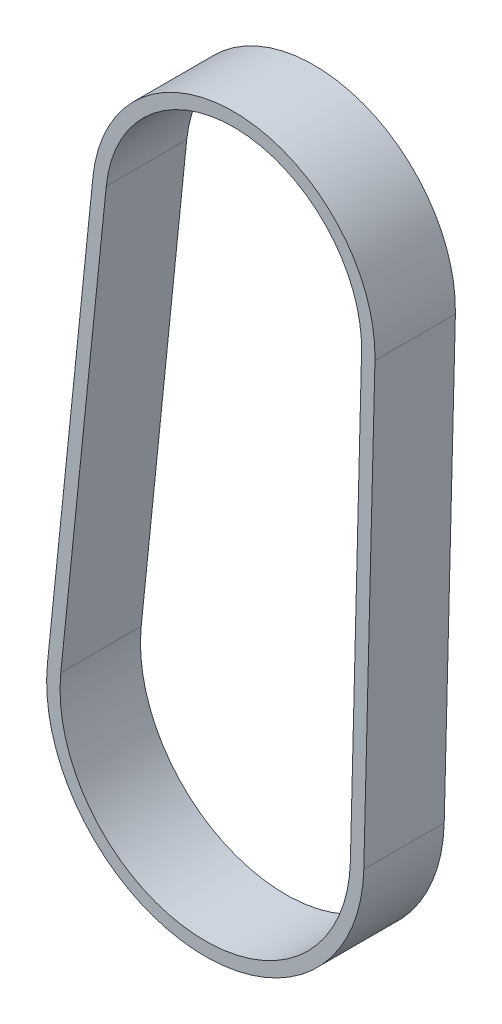
from build123d import *

# Parameters (mm, degrees)
EXTRUDE_THIN1_DEPTH = 9


with BuildPart() as part:
    # Sketch2 → Extrude-Thin1 (new body)
    with BuildSketch(Plane.XY):
        with BuildLine():
            Line((15.818995359, -0.395749097), (14.569448036, -50.343009774))
            ThreePointArc((14.569448036, -50.343009774), (-4.302125021, -67.613268616), (-20.832611838, -48.090432866))
            Line((-20.832611838, -48.090432866), (-15.741581769, 1.612400359))
            ThreePointArc((-15.741581769, 1.612400359), (1.004820519, 15.792009601), (15.818995359, -0.395749097))
        make_face()
        with BuildLine():
            Line((14.319464539, -0.358234833), (13.069917216, -50.30549551))
            ThreePointArc((13.069917216, -50.30549551), (-4.206875019, -66.116295858), (-19.340419288, -48.243277214))
            Line((-19.340419288, -48.243277214), (-14.249389219, 1.459556011))
            ThreePointArc((-14.249389219, 1.459556011), (0.909570517, 14.295036843), (14.319464539, -0.358234833))
        make_face(mode=Mode.SUBTRACT)
    extrude(amount=-EXTRUDE_THIN1_DEPTH)


solid = part.part
